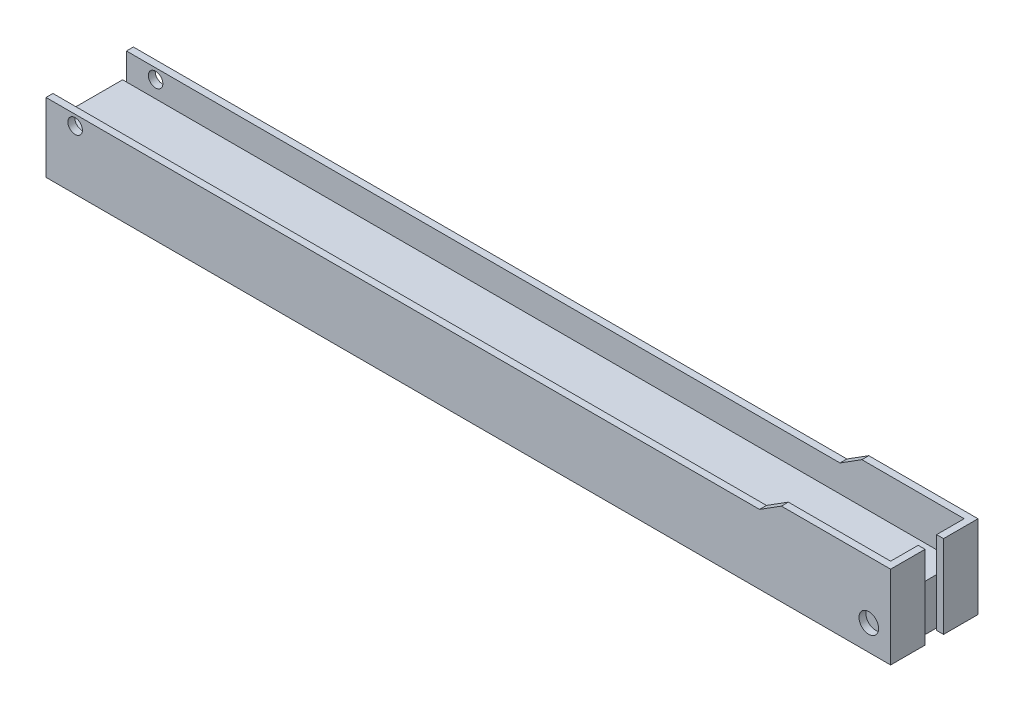
from build123d import *

# Parameters (mm, degrees)
SKETCH1_W           = 147.32
SKETCH1_H           = 15.24
BOSS_EXTRUDE1_DEPTH = 14.478
CUT_EXTRUDE2_DEPTH  = 146.1135
CUT_EXTRUDE5_REACH  = 78.601
SKETCH7_R           = 1.7145
SKETCH9_R           = 1.27
CUT_EXTRUDE6_DEPTH  = 77.60068984
CUT_EXTRUDE7_REACH  = 76.491
SKETCH11_W          = 0.381
SKETCH11_H          = 11.684
CUT_EXTRUDE8_REACH  = 77.233
SKETCH12_W          = 0.381
SKETCH12_H          = 0.676587602
CUT_EXTRUDE9_REACH  = 77.233
SKETCH13_W          = 0.381
SKETCH13_H          = 0.466412398
CUT_EXTRUDE10_REACH = 150.226
SKETCH14_W          = 1.6129
SKETCH14_H          = 14.478


with BuildPart() as part:
    # Sketch1 → Boss-Extrude1 (new body)
    with BuildSketch(Plane(origin=(0, 0, 0), x_dir=(1, 0, 0), z_dir=(0, 1, 0))):
        Rectangle(SKETCH1_W, SKETCH1_H)
    extrude(amount=BOSS_EXTRUDE1_DEPTH)

    # Sketch3 → Cut-Extrude2 (cut)
    with BuildSketch(Plane.ZY.offset(73.66)):
        Polygon((-6.4135, 14.478), (-6.4135, 13.2715), (-6.4135, 1.2065), (-4.466912398, 1.2065), (-4.466912398, 1.7145), (-5.736912398, 1.7145), (-5.736912398, 8.0645), (5.947087602, 8.0645), (5.947087602, 1.7145), (4.677087602, 1.7145), (4.677087602, 1.2065), (6.4135, 1.2065), (6.4135, 13.2715), (6.4135, 14.478), align=None)
    extrude(amount=-CUT_EXTRUDE2_DEPTH, mode=Mode.SUBTRACT)

    # Sketch7 → Cut-Extrude5 (cut, up to next)
    with BuildSketch(Plane.XY.offset(7.62), mode=Mode.PRIVATE) as cut_extrude5_sk1:
        Polygon((50.8, 12.074646248), (54.61, 14.478), (-73.66, 14.478), (-73.66, 12.074646248), align=None)
    cut_extrude5_tool1 = extrude(cut_extrude5_sk1.sketch, amount=-CUT_EXTRUDE5_REACH, mode=Mode.PRIVATE) & part.part
    # Sketch7 → Cut-Extrude5 (cut, up to next)
    with BuildSketch(Plane.XY.offset(7.62), mode=Mode.PRIVATE) as cut_extrude5_sk2:
        with Locations((69.85, 4.445)):
            Circle(SKETCH7_R)
    cut_extrude5_tool2 = extrude(cut_extrude5_sk2.sketch, amount=-CUT_EXTRUDE5_REACH, mode=Mode.PRIVATE) & part.part
    cut_extrude5_1 = cut_extrude5_tool1.solids().sort_by_distance((-10.472714, 13.282362, 7.62))[0]
    add(cut_extrude5_1, mode=Mode.SUBTRACT)
    cut_extrude5_2 = cut_extrude5_tool2.solids().sort_by_distance((69.85, 4.445, 7.62))[0]
    add(cut_extrude5_2, mode=Mode.SUBTRACT)
    cut_extrude5 = cut_extrude5_1 + cut_extrude5_2  # Cut-Extrude5 as one shape, for the pattern or mirror that repeats it

    # Sketch9 → Cut-Extrude6 (cut, through all)
    with BuildSketch(Plane.XY.offset(7.62)):
        with Locations((-68.58, 10.296646248)):
            Circle(SKETCH9_R)
    extrude(amount=-CUT_EXTRUDE6_DEPTH, mode=Mode.SUBTRACT)

    # Sketch11 → Cut-Extrude7 (cut, up to next)
    with BuildSketch(Plane(origin=(0, 8.0645, 0), x_dir=(1, 0, 0), z_dir=(0, 1, 0)), mode=Mode.PRIVATE) as cut_extrude7_sk1:
        with Locations((72.263, -0.105087602)):
            Rectangle(SKETCH11_W, SKETCH11_H)
    cut_extrude7_tool1 = extrude(cut_extrude7_sk1.sketch, amount=-CUT_EXTRUDE7_REACH, mode=Mode.PRIVATE) & part.part
    add(cut_extrude7_tool1.solids().sort_by_distance((72.263, 8.0645, 0.105088))[0], mode=Mode.SUBTRACT)

    # Sketch12 → Cut-Extrude8 (cut, up to next)
    with BuildSketch(Plane(origin=(0, 1.2065, 0), x_dir=(1, 0, 0), z_dir=(0, 1, 0)), mode=Mode.PRIVATE) as cut_extrude8_sk1:
        with Locations((72.263, 6.075206199)):
            Rectangle(SKETCH12_W, SKETCH12_H)
    cut_extrude8_tool1 = extrude(cut_extrude8_sk1.sketch, amount=-CUT_EXTRUDE8_REACH, mode=Mode.PRIVATE) & part.part
    add(cut_extrude8_tool1.solids().sort_by_distance((72.263, 1.2065, -6.075206))[0], mode=Mode.SUBTRACT)

    # Sketch13 → Cut-Extrude9 (cut, up to next)
    with BuildSketch(Plane(origin=(0, 1.2065, 0), x_dir=(1, 0, 0), z_dir=(0, 1, 0)), mode=Mode.PRIVATE) as cut_extrude9_sk1:
        with Locations((72.263, -6.180293801)):
            Rectangle(SKETCH13_W, SKETCH13_H)
    cut_extrude9_tool1 = extrude(cut_extrude9_sk1.sketch, amount=-CUT_EXTRUDE9_REACH, mode=Mode.PRIVATE) & part.part
    add(cut_extrude9_tool1.solids().sort_by_distance((72.263, 1.2065, 6.180294))[0], mode=Mode.SUBTRACT)

    # Sketch14 → Cut-Extrude10 (cut, up to next)
    with BuildSketch(Plane(origin=(73.66, 0, 0), x_dir=(0, 0, -1), z_dir=(1, 0, 0)), mode=Mode.PRIVATE) as cut_extrude10_sk1:
        with Locations((0.80645, 7.239)):
            Rectangle(SKETCH14_W, SKETCH14_H)
    cut_extrude10_tool1 = extrude(cut_extrude10_sk1.sketch, amount=-CUT_EXTRUDE10_REACH, mode=Mode.PRIVATE) & part.part
    # Sketch14 → Cut-Extrude10 (cut, up to next)
    with BuildSketch(Plane(origin=(73.66, 0, 0), x_dir=(0, 0, -1), z_dir=(1, 0, 0)), mode=Mode.PRIVATE) as cut_extrude10_sk2:
        with Locations((-0.80645, 7.239)):
            Rectangle(SKETCH14_W, SKETCH14_H)
    cut_extrude10_tool2 = extrude(cut_extrude10_sk2.sketch, amount=-CUT_EXTRUDE10_REACH, mode=Mode.PRIVATE) & part.part
    add(cut_extrude10_tool1.solids().sort_by_distance((73.66, 7.239, -0.80645))[0], mode=Mode.SUBTRACT)
    add(cut_extrude10_tool2.solids().sort_by_distance((73.66, 7.239, 0.80645))[0], mode=Mode.SUBTRACT)

    # Mirror1: Cut-Extrude5 across plane
    add(cut_extrude5.mirror(Plane(origin=(0, 0, 0), x_dir=(1, 0, 0), z_dir=(0, 0, -1))), mode=Mode.SUBTRACT)


solid = part.part
